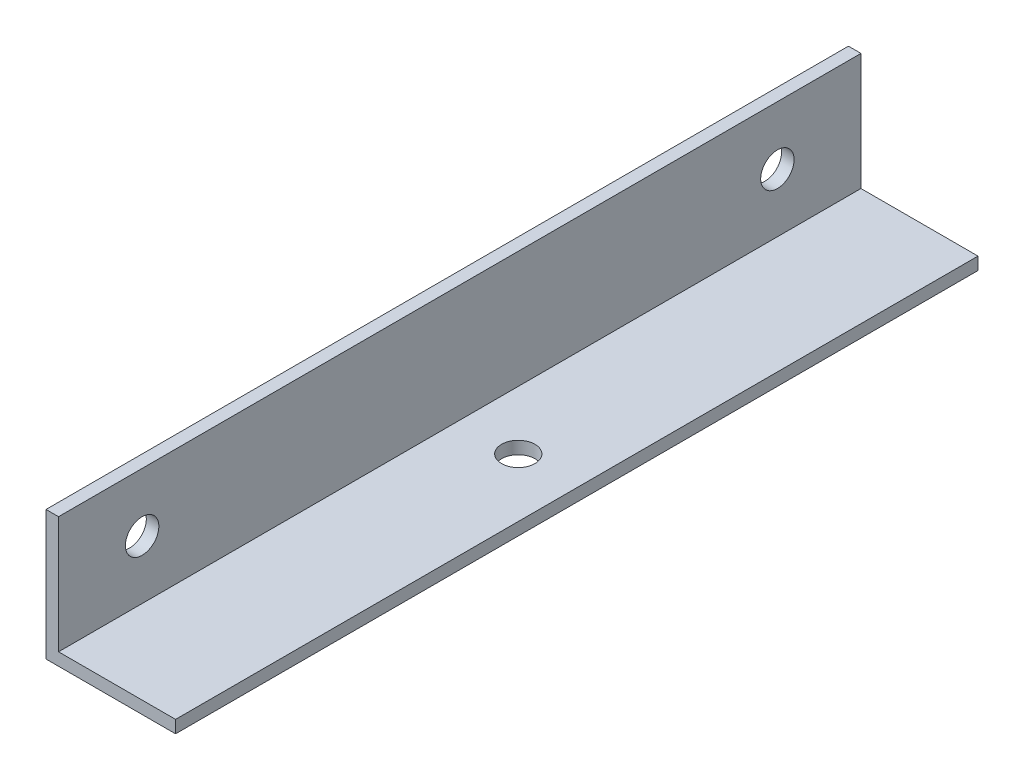
from build123d import *

# Parameters (mm, degrees)
EXTRU_MINCE1_DEPTH      = 96
ESQUISSE2_R             = 2
ENL_V_MAT_EXTRU_1_DEPTH = 99.245865053
ESQUISSE3_R             = 2
ENL_V_MAT_EXTRU_2_DEPTH = 99.245865053


with BuildPart() as part:
    # Esquisse1 → Extru.-Mince1 (new body)
    with BuildSketch(Plane.XY):
        Polygon((0, 15.5), (0, 0), (15.5, 0), (15.5, 1.5), (1.5, 1.5), (1.5, 15.5), align=None)
    extrude(amount=EXTRU_MINCE1_DEPTH)

    # Esquisse2 → Enlèv. mat.-Extru.1 (cut, through all)
    with BuildSketch(Plane(origin=(1.5, 0, 0), x_dir=(0, 0, -1), z_dir=(1, 0, 0))):
        with Locations(Location((-86, 8.5, 0), (0, 0, 90))):
            Circle(ESQUISSE2_R)
        with Locations(Location((-10, 8.5, 0), (0, 0, 270))):
            Circle(ESQUISSE2_R)
    extrude(amount=-ENL_V_MAT_EXTRU_1_DEPTH, mode=Mode.SUBTRACT)

    # Esquisse3 → Enlèv. mat.-Extru.2 (cut, through all)
    with BuildSketch(Plane(origin=(0, 1.5, 0), x_dir=(1, 0, 0), z_dir=(0, 1, 0))):
        with Locations(Location((8.5, -48, 0), (0, 0, 270))):
            Circle(ESQUISSE3_R)
    extrude(amount=-ENL_V_MAT_EXTRU_2_DEPTH, mode=Mode.SUBTRACT)


solid = part.part
